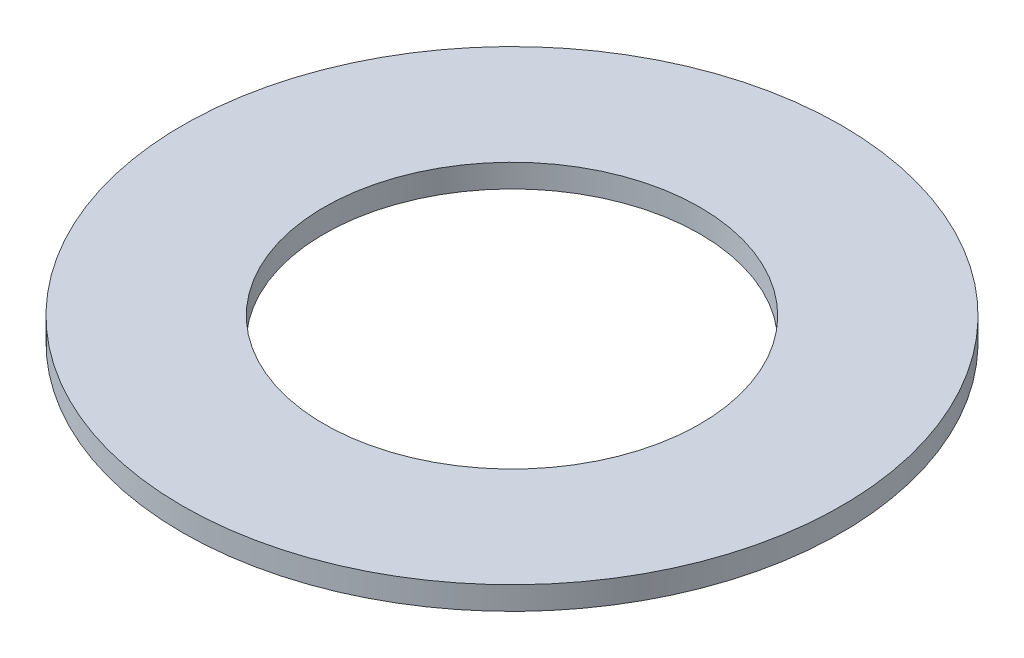
from build123d import *

# Parameters (mm, degrees)
SKETCH1_W = 24.5
SKETCH1_H = 4


with BuildPart() as part:
    # Sketch1 → Revolve1 (revolve)
    with BuildSketch(Plane.XY, mode=Mode.PRIVATE) as revolve1_sk:
        with Locations((44.75, 0)):
            Rectangle(SKETCH1_W, SKETCH1_H)
    revolve(revolve1_sk.sketch.rotate(Axis((0, 0, 0), (0, 1, 0)), 90), axis=Axis((0, 0, 0), (0, 1, 0)))


solid = part.part
